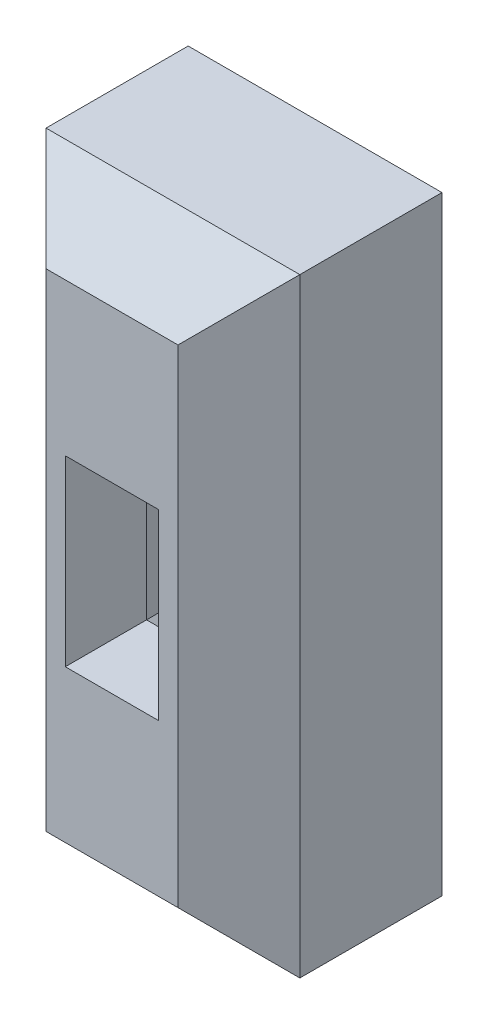
from build123d import *
from OCP.BRepFilletAPI import BRepFilletAPI_MakeChamfer

# Parameters (mm, degrees)
ESBO_O1_W                = 12.5
ESBO_O1_H                = 30
RESSALTO_EXTRUS_O1_DEPTH = 10
ESBO_O2_W                = 4.6
ESBO_O2_H                = 9
CORTE_EXTRUS_O1_DEPTH    = 20.080421903
CHANFRO1_SIZE            = 3
CHANFRO2_SIZE            = 6
CHANFRO2_SIZE2           = 2.797845949


with BuildPart() as part:
    # Esboço1 → Ressalto-extrusão1 (new body)
    with BuildSketch(Plane.XY):
        Rectangle(ESBO_O1_W, ESBO_O1_H)
    extrude(amount=RESSALTO_EXTRUS_O1_DEPTH)

    # Esboço2 → Corte-extrusão1 (cut, through all)
    with BuildSketch(Plane.XY.offset(10)):
        Rectangle(ESBO_O2_W, ESBO_O2_H)
    extrude(amount=-CORTE_EXTRUS_O1_DEPTH, mode=Mode.SUBTRACT)

    # Chanfro1
    chanfro1_edges = [part.edges().sort_by_distance(p)[0] for p in [
        (-6.25, 0, 10),
        (0, -15, 10),
        (6.25, 0, 10),
        (0, 15, 10),
    ]]
    chamfer(chanfro1_edges, length=CHANFRO1_SIZE)

    # Chanfro2: one chamfer whose edges measure the first distance from different faces: ONE call of the kernel's chamfer builder (chamfer() names one face for all edges)
    chanfro2_edges_1 = [part.edges().sort_by_distance(p)[0] for p in [
        (2.3, 0, 0),
    ]]
    chanfro2_side_1 = [part.faces().sort_by_distance(p)[0] for p in [
        (2.3, 0, 5),
    ]]
    chanfro2_edges_2 = [part.edges().sort_by_distance(p)[0] for p in [
        (0, -4.5, 0),
    ]]
    chanfro2_side_2 = [part.faces().sort_by_distance(p)[0] for p in [
        (0, -4.5, 5),
    ]]
    chanfro2_edges_3 = [part.edges().sort_by_distance(p)[0] for p in [
        (-2.3, 0, 0),
    ]]
    chanfro2_side_3 = [part.faces().sort_by_distance(p)[0] for p in [
        (-2.3, 0, 5),
    ]]
    chanfro2_edges_4 = [part.edges().sort_by_distance(p)[0] for p in [
        (0, 4.5, 0),
    ]]
    chanfro2_side_4 = [part.faces().sort_by_distance(p)[0] for p in [
        (0, 4.5, 5),
    ]]
    chanfro2 = BRepFilletAPI_MakeChamfer(part.part.solid().wrapped)
    for e in chanfro2_edges_1:
        chanfro2.Add(CHANFRO2_SIZE, CHANFRO2_SIZE2, e.wrapped, chanfro2_side_1[0].wrapped)  # the first distance lies on this face
    for e in chanfro2_edges_2:
        chanfro2.Add(CHANFRO2_SIZE, CHANFRO2_SIZE2, e.wrapped, chanfro2_side_2[0].wrapped)  # the first distance lies on this face
    for e in chanfro2_edges_3:
        chanfro2.Add(CHANFRO2_SIZE, CHANFRO2_SIZE2, e.wrapped, chanfro2_side_3[0].wrapped)  # the first distance lies on this face
    for e in chanfro2_edges_4:
        chanfro2.Add(CHANFRO2_SIZE, CHANFRO2_SIZE2, e.wrapped, chanfro2_side_4[0].wrapped)  # the first distance lies on this face
    add(Compound.cast(chanfro2.Shape()), mode=Mode.REPLACE)


solid = part.part
